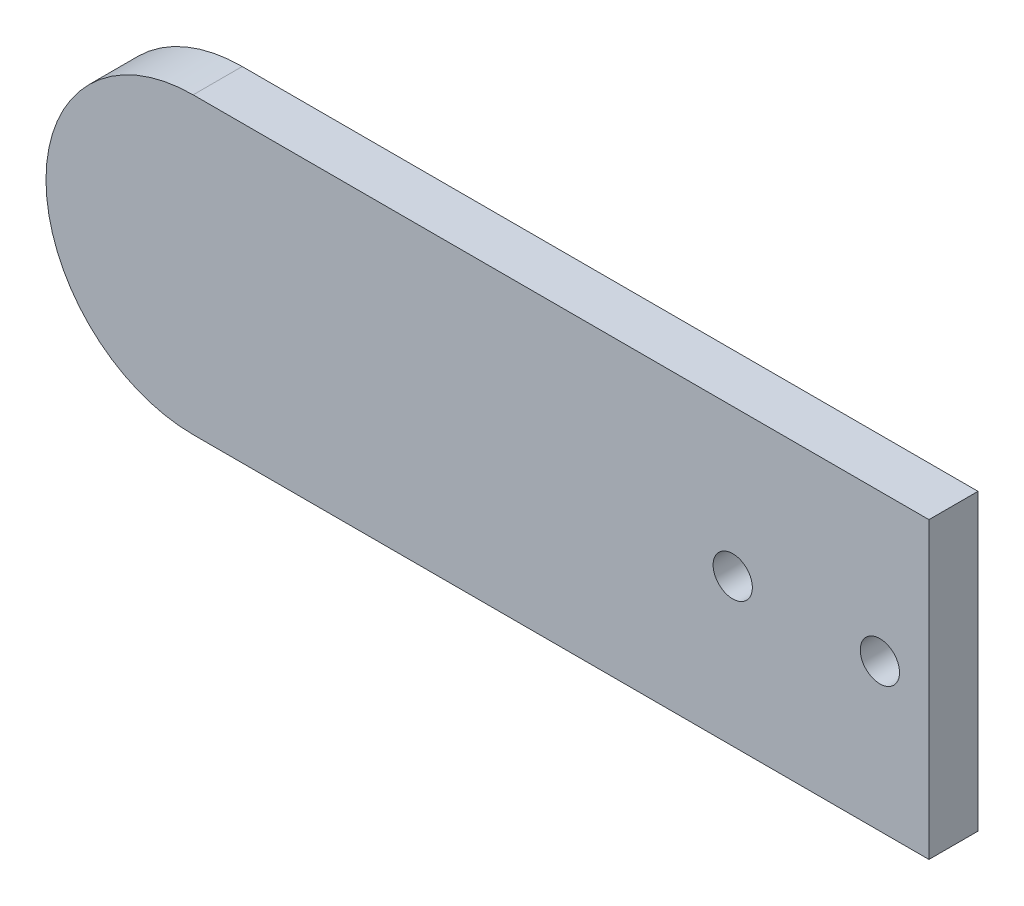
from build123d import *

# Parameters (mm, degrees)
BOSS_EXTRUDE2_DEPTH = 5
SKETCH3_R           = 2
CUT_EXTRUDE1_DEPTH  = 48.696960071
SKETCH4_R           = 7.5
BOSS_EXTRUDE5_DEPTH = 1
SKETCH6_R           = 5
BOSS_EXTRUDE6_DEPTH = 5


with BuildPart() as part:
    # Sketch1 → Boss-Extrude2 (new body)
    with BuildSketch(Plane.XY):
        with BuildLine():
            Line((-30, 15), (45, 15))
            Line((45, 15), (45, -15))
            Line((45, -15), (-30, -15))
            ThreePointArc((-30, -15), (-45, 0), (-30, 15))
        make_face()
    extrude(amount=BOSS_EXTRUDE2_DEPTH)

    # Sketch3 → Cut-Extrude1 (cut, through all)
    with BuildSketch(Plane(origin=(0, 0, 0), x_dir=(-1, 0, 0), z_dir=(0, 0, -1))):
        with Locations((-40, 0)):
            Circle(SKETCH3_R)
        with Locations((-25, 0)):
            Circle(SKETCH3_R)
    extrude(amount=-CUT_EXTRUDE1_DEPTH, mode=Mode.SUBTRACT)

    # Sketch4 → Boss-Extrude5 (add)
    with BuildSketch(Plane(origin=(0, 0, 0), x_dir=(-1, 0, 0), z_dir=(0, 0, -1))):
        with Locations(Location((20, 0, 0), (0, 0, 180))):
            Circle(SKETCH4_R)
    extrude(amount=BOSS_EXTRUDE5_DEPTH)

    # Sketch6 → Boss-Extrude6 (add)
    with BuildSketch(Plane(origin=(0, 0, -1), x_dir=(-1, 0, 0), z_dir=(0, 0, -1))):
        with Locations((20, 0)):
            Circle(SKETCH6_R)
    extrude(amount=BOSS_EXTRUDE6_DEPTH)


solid = part.part
